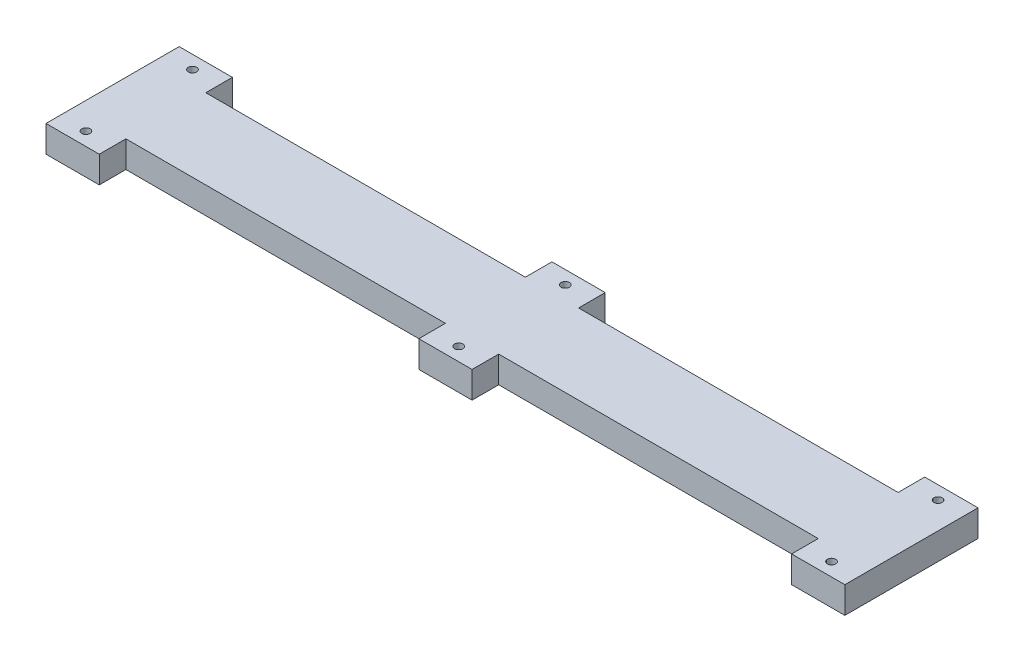
from build123d import *

# Parameters (mm, degrees)
IZIM1_W                     = 300
IZIM1_H                     = 50
Y_KSEKLIK_EKSTR_ZYON1_DEPTH = 10
IZIM2_R                     = 1.55
IZIM2_W                     = 120
IZIM2_H                     = 10
KES_EKSTR_ZYON1_DEPTH       = 10


with BuildPart() as part:
    # Çizim1 → Yükseklik-Ekstrüzyon1 (new body)
    with BuildSketch(Plane(origin=(0, 0, 0), x_dir=(1, 0, 0), z_dir=(0, 1, 0))):
        Rectangle(IZIM1_W, IZIM1_H)
    extrude(amount=Y_KSEKLIK_EKSTR_ZYON1_DEPTH)

    # Çizim2 → Kes-Ekstrüzyon1 (cut)
    with BuildSketch(Plane(origin=(0, 10, 0), x_dir=(1, 0, 0), z_dir=(0, 1, 0))):
        with Locations(Location((140, 20, 0), (0, 0, 270))):
            Circle(IZIM2_R)
        with Locations(Location((0, 20, 0), (0, 0, 270))):
            Circle(IZIM2_R)
        with Locations(Location((-140, 20, 0), (0, 0, 270))):
            Circle(IZIM2_R)
        with Locations(Location((0, -20, 0), (0, 0, 270))):
            Circle(IZIM2_R)
        with Locations(Location((-140, -20, 0), (0, 0, 270))):
            Circle(IZIM2_R)
        with Locations(Location((140, -20, 0), (0, 0, 270))):
            Circle(IZIM2_R)
        with Locations((-70, -20)):
            Rectangle(IZIM2_W, IZIM2_H)
        with Locations((70, -20)):
            Rectangle(IZIM2_W, IZIM2_H)
        with Locations((-70, 20)):
            Rectangle(IZIM2_W, IZIM2_H)
        with Locations((70, 20)):
            Rectangle(IZIM2_W, IZIM2_H)
    extrude(amount=-KES_EKSTR_ZYON1_DEPTH, mode=Mode.SUBTRACT)


solid = part.part
